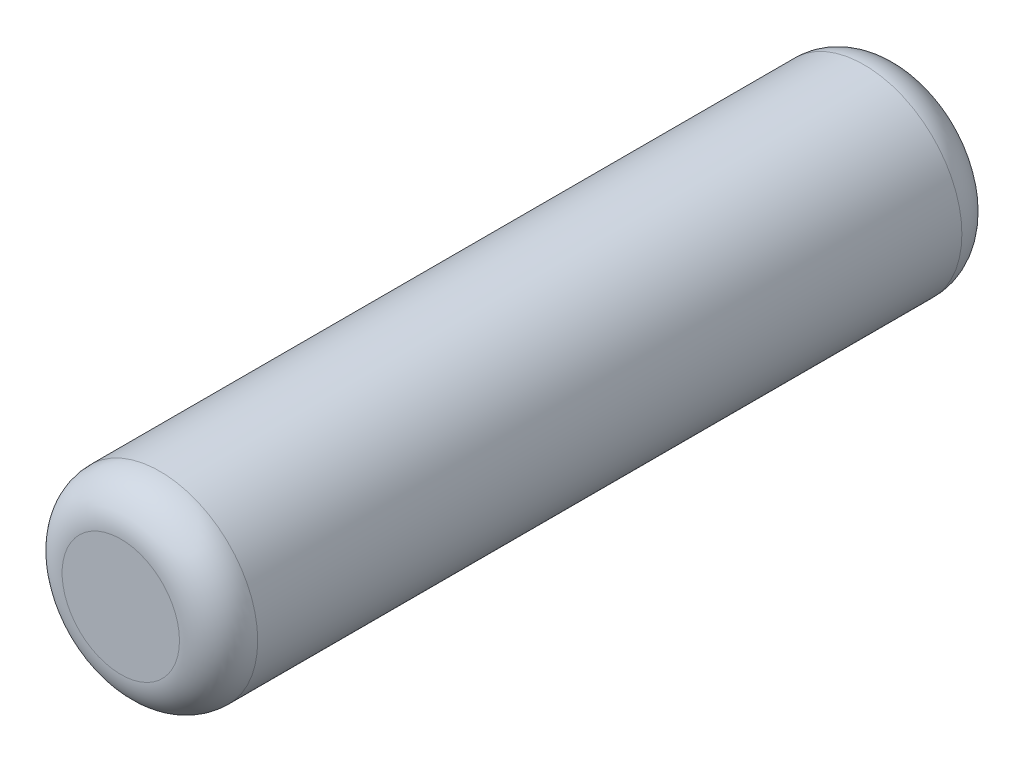
from build123d import *

# Parameters (mm, degrees)
ESQUISSE1_R          = 2.5
BASE_EXTRUSION_DEPTH = 20
CONG_1_R             = 1


with BuildPart() as part:
    # Esquisse1 → Base-Extrusion (new body)
    with BuildSketch(Plane.XY):
        Circle(ESQUISSE1_R)
    extrude(amount=BASE_EXTRUSION_DEPTH)

    # Congé1
    cong_1_edges = [part.edges().sort_by_distance(p)[0] for p in [
        (-2.5, 0, 0),
        (-2.5, 0, 20),
    ]]
    fillet(cong_1_edges, radius=CONG_1_R)


solid = part.part
